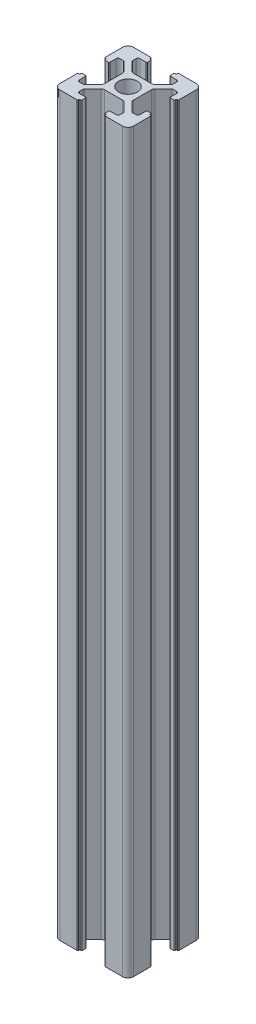
from build123d import *

# Parameters (mm, degrees)
SKETCH_1_R      = 2.55
EXTRUDE_1_DEPTH = 200


with BuildPart() as part:
    # 草图1 → 凸台-拉伸1 (new body)
    with BuildSketch(Plane(origin=(0, 0, 0), x_dir=(1, 0, 0), z_dir=(0, 1, 0))):
        with BuildLine():
            Line((19.761209246, 22.533499136), (19.761209246, 21.633499136))
            ThreePointArc((19.761209246, 21.633499136), (19.702630602, 21.49207778), (19.561209246, 21.433499136))
            Line((19.561209246, 21.433499136), (17.861209246, 21.433499136))
            ThreePointArc((17.861209246, 21.433499136), (17.507655855, 21.287052526), (17.361209246, 20.933499136))
            Line((17.361209246, 20.933499136), (17.361209246, 20.001266089))
            ThreePointArc((17.361209246, 20.001266089), (17.39926948, 19.809924373), (17.507655855, 19.647712698))
            Line((17.507655855, 19.647712698), (19.728976199, 17.426392355))
            ThreePointArc((19.728976199, 17.426392355), (20.053399548, 17.209619603), (20.43608298, 17.133499136))
            Line((20.43608298, 17.133499136), (25.286335512, 17.133499136))
            ThreePointArc((25.286335512, 17.133499136), (25.669018944, 17.209619603), (25.993442293, 17.426392355))
            Line((25.993442293, 17.426392355), (28.214762636, 19.647712698))
            ThreePointArc((28.214762636, 19.647712698), (28.323149012, 19.809924373), (28.361209246, 20.001266089))
            Line((28.361209246, 20.001266089), (28.361209246, 20.933499136))
            ThreePointArc((28.361209246, 20.933499136), (28.214762636, 21.287052526), (27.861209246, 21.433499136))
            Line((27.861209246, 21.433499136), (26.161209246, 21.433499136))
            ThreePointArc((26.161209246, 21.433499136), (26.01978789, 21.49207778), (25.961209246, 21.633499136))
            Line((25.961209246, 21.633499136), (25.961209246, 22.533499136))
            ThreePointArc((25.961209246, 22.533499136), (26.01978789, 22.674920492), (26.161209246, 22.733499136))
            Line((26.161209246, 22.733499136), (26.311209246, 22.733499136))
            ThreePointArc((26.311209246, 22.733499136), (26.452630602, 22.79207778), (26.511209246, 22.933499136))
            Line((26.511209246, 22.933499136), (26.511209246, 23.033499136))
            ThreePointArc((26.511209246, 23.033499136), (26.56978789, 23.174920492), (26.711209246, 23.233499136))
            Line((26.711209246, 23.233499136), (31.361209246, 23.233499136))
            ThreePointArc((31.361209246, 23.233499136), (32.421869418, 22.794159308), (32.861209246, 21.733499136))
            Line((32.861209246, 21.733499136), (32.861209246, 17.083499136))
            ThreePointArc((32.861209246, 17.083499136), (32.802630602, 16.94207778), (32.661209246, 16.883499136))
            Line((32.661209246, 16.883499136), (32.561209246, 16.883499136))
            ThreePointArc((32.561209246, 16.883499136), (32.41978789, 16.824920492), (32.361209246, 16.683499136))
            Line((32.361209246, 16.683499136), (32.361209246, 16.533499136))
            ThreePointArc((32.361209246, 16.533499136), (32.302630602, 16.39207778), (32.161209246, 16.333499136))
            Line((32.161209246, 16.333499136), (31.261209246, 16.333499136))
            ThreePointArc((31.261209246, 16.333499136), (31.11978789, 16.39207778), (31.061209246, 16.533499136))
            Line((31.061209246, 16.533499136), (31.061209246, 18.233499136))
            ThreePointArc((31.061209246, 18.233499136), (30.914762636, 18.587052526), (30.561209246, 18.733499136))
            Line((30.561209246, 18.733499136), (29.628976199, 18.733499136))
            ThreePointArc((29.628976199, 18.733499136), (29.437634483, 18.695438902), (29.275422808, 18.587052526))
            Line((29.275422808, 18.587052526), (27.054102465, 16.365732183))
            ThreePointArc((27.054102465, 16.365732183), (26.837329713, 16.041308834), (26.761209246, 15.658625402))
            Line((26.761209246, 15.658625402), (26.761209246, 10.80837287))
            ThreePointArc((26.761209246, 10.80837287), (26.837329713, 10.425689438), (27.054102465, 10.101266089))
            Line((27.054102465, 10.101266089), (29.275422808, 7.879945745))
            ThreePointArc((29.275422808, 7.879945745), (29.437634483, 7.77155937), (29.628976199, 7.733499136))
            Line((29.628976199, 7.733499136), (30.561209246, 7.733499136))
            ThreePointArc((30.561209246, 7.733499136), (30.914762636, 7.879945745), (31.061209246, 8.233499136))
            Line((31.061209246, 8.233499136), (31.061209246, 9.933499136))
            ThreePointArc((31.061209246, 9.933499136), (31.11978789, 10.074920492), (31.261209246, 10.133499136))
            Line((31.261209246, 10.133499136), (32.161209246, 10.133499136))
            ThreePointArc((32.161209246, 10.133499136), (32.302630602, 10.074920492), (32.361209246, 9.933499136))
            Line((32.361209246, 9.933499136), (32.361209246, 9.783499136))
            ThreePointArc((32.361209246, 9.783499136), (32.41978789, 9.64207778), (32.561209246, 9.583499136))
            Line((32.561209246, 9.583499136), (32.661209246, 9.583499136))
            ThreePointArc((32.661209246, 9.583499136), (32.802630602, 9.524920492), (32.861209246, 9.383499136))
            Line((32.861209246, 9.383499136), (32.861209246, 4.733499136))
            ThreePointArc((32.861209246, 4.733499136), (32.421869418, 3.672838964), (31.361209246, 3.233499136))
            Line((31.361209246, 3.233499136), (26.711209246, 3.233499136))
            ThreePointArc((26.711209246, 3.233499136), (26.56978789, 3.29207778), (26.511209246, 3.433499136))
            Line((26.511209246, 3.433499136), (26.511209246, 3.533499136))
            ThreePointArc((26.511209246, 3.533499136), (26.452630602, 3.674920492), (26.311209246, 3.733499136))
            Line((26.311209246, 3.733499136), (26.161209246, 3.733499136))
            ThreePointArc((26.161209246, 3.733499136), (26.01978789, 3.79207778), (25.961209246, 3.933499136))
            Line((25.961209246, 3.933499136), (25.961209246, 4.833499136))
            ThreePointArc((25.961209246, 4.833499136), (26.01978789, 4.974920492), (26.161209246, 5.033499136))
            Line((26.161209246, 5.033499136), (27.861209246, 5.033499136))
            ThreePointArc((27.861209246, 5.033499136), (28.214762636, 5.179945745), (28.361209246, 5.533499136))
            Line((28.361209246, 5.533499136), (28.361209246, 6.465732183))
            ThreePointArc((28.361209246, 6.465732183), (28.323149012, 6.657073899), (28.214762636, 6.819285573))
            Line((28.214762636, 6.819285573), (25.993442293, 9.040605917))
            ThreePointArc((25.993442293, 9.040605917), (25.669018944, 9.257378668), (25.286335512, 9.333499136))
            Line((25.286335512, 9.333499136), (20.43608298, 9.333499136))
            ThreePointArc((20.43608298, 9.333499136), (20.053399548, 9.257378668), (19.728976199, 9.040605917))
            Line((19.728976199, 9.040605917), (17.507655855, 6.819285573))
            ThreePointArc((17.507655855, 6.819285573), (17.39926948, 6.657073899), (17.361209246, 6.465732183))
            Line((17.361209246, 6.465732183), (17.361209246, 5.533499136))
            ThreePointArc((17.361209246, 5.533499136), (17.507655855, 5.179945745), (17.861209246, 5.033499136))
            Line((17.861209246, 5.033499136), (19.561209246, 5.033499136))
            ThreePointArc((19.561209246, 5.033499136), (19.702630602, 4.974920492), (19.761209246, 4.833499136))
            Line((19.761209246, 4.833499136), (19.761209246, 3.933499136))
            ThreePointArc((19.761209246, 3.933499136), (19.702630602, 3.79207778), (19.561209246, 3.733499136))
            Line((19.561209246, 3.733499136), (19.411209246, 3.733499136))
            ThreePointArc((19.411209246, 3.733499136), (19.26978789, 3.674920492), (19.211209246, 3.533499136))
            Line((19.211209246, 3.533499136), (19.211209246, 3.433499136))
            ThreePointArc((19.211209246, 3.433499136), (19.152630602, 3.29207778), (19.011209246, 3.233499136))
            Line((19.011209246, 3.233499136), (14.361209246, 3.233499136))
            ThreePointArc((14.361209246, 3.233499136), (13.300549074, 3.672838964), (12.861209246, 4.733499136))
            Line((12.861209246, 4.733499136), (12.861209246, 9.383499136))
            ThreePointArc((12.861209246, 9.383499136), (12.91978789, 9.524920492), (13.061209246, 9.583499136))
            Line((13.061209246, 9.583499136), (13.161209246, 9.583499136))
            ThreePointArc((13.161209246, 9.583499136), (13.302630602, 9.64207778), (13.361209246, 9.783499136))
            Line((13.361209246, 9.783499136), (13.361209246, 9.933499136))
            ThreePointArc((13.361209246, 9.933499136), (13.41978789, 10.074920492), (13.561209246, 10.133499136))
            Line((13.561209246, 10.133499136), (14.461209246, 10.133499136))
            ThreePointArc((14.461209246, 10.133499136), (14.602630602, 10.074920492), (14.661209246, 9.933499136))
            Line((14.661209246, 9.933499136), (14.661209246, 8.233499136))
            ThreePointArc((14.661209246, 8.233499136), (14.807655855, 7.879945745), (15.161209246, 7.733499136))
            Line((15.161209246, 7.733499136), (16.093442293, 7.733499136))
            ThreePointArc((16.093442293, 7.733499136), (16.284784009, 7.77155937), (16.446995684, 7.879945745))
            Line((16.446995684, 7.879945745), (18.668316027, 10.101266089))
            ThreePointArc((18.668316027, 10.101266089), (18.885088778, 10.425689438), (18.961209246, 10.80837287))
            Line((18.961209246, 10.80837287), (18.961209246, 13.233499136))
            Line((18.961209246, 13.233499136), (18.961209246, 15.658625402))
            ThreePointArc((18.961209246, 15.658625402), (18.885088778, 16.041308834), (18.668316027, 16.365732183))
            Line((18.668316027, 16.365732183), (16.446995684, 18.587052526))
            ThreePointArc((16.446995684, 18.587052526), (16.284784009, 18.695438902), (16.093442293, 18.733499136))
            Line((16.093442293, 18.733499136), (15.161209246, 18.733499136))
            ThreePointArc((15.161209246, 18.733499136), (14.807655855, 18.587052526), (14.661209246, 18.233499136))
            Line((14.661209246, 18.233499136), (14.661209246, 16.533499136))
            ThreePointArc((14.661209246, 16.533499136), (14.602630602, 16.39207778), (14.461209246, 16.333499136))
            Line((14.461209246, 16.333499136), (13.561209246, 16.333499136))
            ThreePointArc((13.561209246, 16.333499136), (13.41978789, 16.39207778), (13.361209246, 16.533499136))
            Line((13.361209246, 16.533499136), (13.361209246, 16.683499136))
            ThreePointArc((13.361209246, 16.683499136), (13.302630602, 16.824920492), (13.161209246, 16.883499136))
            Line((13.161209246, 16.883499136), (13.061209246, 16.883499136))
            ThreePointArc((13.061209246, 16.883499136), (12.91978789, 16.94207778), (12.861209246, 17.083499136))
            Line((12.861209246, 17.083499136), (12.861209246, 21.733499136))
            ThreePointArc((12.861209246, 21.733499136), (13.300549074, 22.794159308), (14.361209246, 23.233499136))
            Line((14.361209246, 23.233499136), (19.011209246, 23.233499136))
            ThreePointArc((19.011209246, 23.233499136), (19.152630602, 23.174920492), (19.211209246, 23.033499136))
            Line((19.211209246, 23.033499136), (19.211209246, 22.933499136))
            ThreePointArc((19.211209246, 22.933499136), (19.26978789, 22.79207778), (19.411209246, 22.733499136))
            Line((19.411209246, 22.733499136), (19.561209246, 22.733499136))
            ThreePointArc((19.561209246, 22.733499136), (19.702630602, 22.674920492), (19.761209246, 22.533499136))
        make_face()
        with Locations(Location((22.861209246, 13.233499136, 0), (0, 0, 270))):
            Circle(SKETCH_1_R, mode=Mode.SUBTRACT)
    extrude(amount=EXTRUDE_1_DEPTH)


solid = part.part
